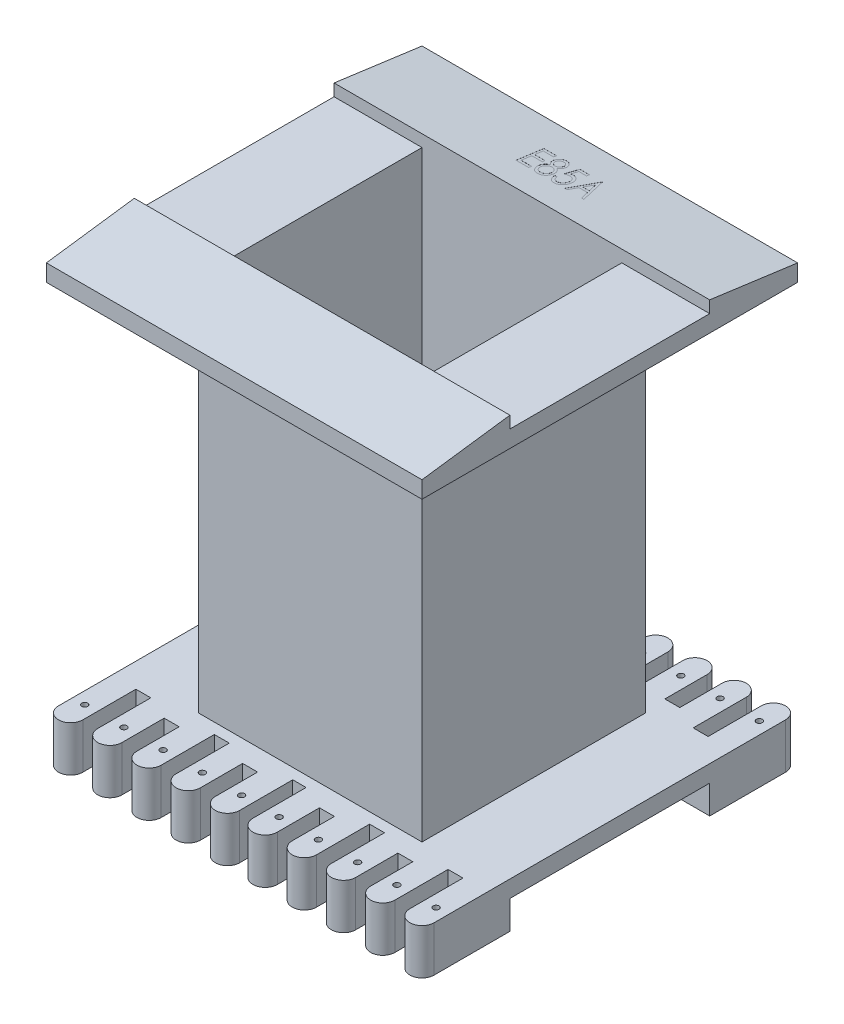
from build123d import *

# Parameters (mm, degrees)
SKETCH2_W           = 31.8
SKETCH2_H           = 31.8
SKETCH2_W_2         = 28.4
SKETCH2_H_2         = 28.4
BOSS_EXTRUDE1_DEPTH = 26.5
SKETCH4_W           = 53.4
SKETCH4_H           = 53.4
SKETCH4_W_2         = 28.4
SKETCH4_H_2         = 28.4
BOSS_EXTRUDE2_DEPTH = 2.4
BOSS_EXTRUDE3_DEPTH = 26.7
SKETCH7_R           = 0.425
CUT_EXTRUDE1_DEPTH  = 3
BOSS_EXTRUDE4_START = 4.05
BOSS_EXTRUDE4_DEPTH = 4.05
CUT_EXTRUDE2_DEPTH  = 0.01


with BuildPart() as part:
    # Sketch2 → Boss-Extrude1 (new, symmetric)
    with BuildSketch(Plane(origin=(0, 0, 0), x_dir=(1, 0, 0), z_dir=(0, 1, 0))):
        Rectangle(SKETCH2_W, SKETCH2_H)
        Rectangle(SKETCH2_W_2, SKETCH2_H_2, mode=Mode.SUBTRACT)
    extrude(amount=BOSS_EXTRUDE1_DEPTH, both=True)

    # Sketch4 → Boss-Extrude2 (add)
    with BuildSketch(Plane(origin=(0, 26.5, 0), x_dir=(1, 0, 0), z_dir=(0, 1, 0))):
        Rectangle(SKETCH4_W, SKETCH4_H)
        Rectangle(SKETCH4_W_2, SKETCH4_H_2, mode=Mode.SUBTRACT)
    boss_extrude2 = extrude(amount=BOSS_EXTRUDE2_DEPTH)

    # Mirror1: Boss-Extrude2 across plane
    add(boss_extrude2.mirror(Plane.ZX))

    # Sketch5 → Boss-Extrude3 (add, symmetric)
    with BuildSketch(Plane(origin=(0, 0, 0), x_dir=(0, 0, -1), z_dir=(1, 0, 0))):
        Polygon((-26.7, 28.9), (-14.2, 30.6), (-14.2, 28.9), align=None)
        Polygon((14.2, 30.6), (14.2, 28.9), (26.7, 28.9), align=None)
    extrude(amount=BOSS_EXTRUDE3_DEPTH, both=True)

    # Sketch7 → Cut-Extrude1 (cut)
    with BuildSketch(Plane.XZ.offset(28.9)):
        with Locations(Location((-24.975, 22.975, 0), (0, 0, 270))):
            Circle(SKETCH7_R)
        with Locations(Location((-19.4, 22.975, 0), (0, 0, 270))):
            Circle(SKETCH7_R)
        with Locations(Location((-13.825, 22.975, 0), (0, 0, 270))):
            Circle(SKETCH7_R)
        with Locations(Location((-8.25, 22.975, 0), (0, 0, 270))):
            Circle(SKETCH7_R)
        with Locations(Location((-2.675, 22.975, 0), (0, 0, 270))):
            Circle(SKETCH7_R)
        with Locations(Location((19.4, 22.975, 0), (0, 0, 90))):
            Circle(SKETCH7_R)
        with Locations(Location((13.825, 22.975, 0), (0, 0, 90))):
            Circle(SKETCH7_R)
        with Locations(Location((8.25, 22.975, 0), (0, 0, 90))):
            Circle(SKETCH7_R)
        with Locations(Location((2.675, 22.975, 0), (0, 0, 90))):
            Circle(SKETCH7_R)
        with Locations(Location((24.975, 22.975, 0), (0, 0, 90))):
            Circle(SKETCH7_R)
        with Locations(Location((24.975, -22.975, 0), (0, 0, 270))):
            Circle(SKETCH7_R)
        with Locations(Location((2.675, -22.975, 0), (0, 0, 270))):
            Circle(SKETCH7_R)
        with Locations(Location((8.25, -22.975, 0), (0, 0, 270))):
            Circle(SKETCH7_R)
        with Locations(Location((13.825, -22.975, 0), (0, 0, 270))):
            Circle(SKETCH7_R)
        with Locations(Location((19.4, -22.975, 0), (0, 0, 270))):
            Circle(SKETCH7_R)
        with Locations(Location((-2.675, -22.975, 0), (0, 0, 90))):
            Circle(SKETCH7_R)
        with Locations(Location((-8.25, -22.975, 0), (0, 0, 90))):
            Circle(SKETCH7_R)
        with Locations(Location((-13.825, -22.975, 0), (0, 0, 90))):
            Circle(SKETCH7_R)
        with Locations(Location((-19.4, -22.975, 0), (0, 0, 90))):
            Circle(SKETCH7_R)
        with Locations(Location((-24.975, -22.975, 0), (0, 0, 90))):
            Circle(SKETCH7_R)
        with BuildLine():
            Line((-26.7, 26.7), (-26.7, 24.975))
            ThreePointArc((-26.7, 24.975), (-24.975, 26.7), (-23.25, 24.975))
            Line((-23.25, 24.975), (-23.25, 17.425))
            Line((-23.25, 17.425), (-21.125, 17.425))
            Line((-21.125, 17.425), (-21.125, 24.975))
            ThreePointArc((-21.125, 24.975), (-19.4, 26.7), (-17.675, 24.975))
            Line((-17.675, 24.975), (-17.675, 18.975))
            Line((-17.675, 18.975), (-15.55, 18.975))
            Line((-15.55, 18.975), (-15.55, 24.975))
            ThreePointArc((-15.55, 24.975), (-13.825, 26.7), (-12.1, 24.975))
            Line((-12.1, 24.975), (-12.1, 17.425))
            Line((-12.1, 17.425), (-9.975, 17.425))
            Line((-9.975, 17.425), (-9.975, 24.975))
            ThreePointArc((-9.975, 24.975), (-8.25, 26.7), (-6.525, 24.975))
            Line((-6.525, 24.975), (-6.525, 18.975))
            Line((-6.525, 18.975), (-4.4, 18.975))
            Line((-4.4, 18.975), (-4.4, 24.975))
            ThreePointArc((-4.4, 24.975), (-2.675, 26.7), (-0.95, 24.975))
            Line((-0.95, 24.975), (-0.95, 17.425))
            Line((-0.95, 17.425), (0.95, 17.425))
            Line((0.95, 17.425), (0.95, 24.975))
            ThreePointArc((0.95, 24.975), (2.675, 26.7), (4.4, 24.975))
            Line((4.4, 24.975), (4.4, 18.975))
            Line((4.4, 18.975), (6.525, 18.975))
            Line((6.525, 18.975), (6.525, 24.975))
            ThreePointArc((6.525, 24.975), (8.25, 26.7), (9.975, 24.975))
            Line((9.975, 24.975), (9.975, 17.425))
            Line((9.975, 17.425), (12.1, 17.425))
            Line((12.1, 17.425), (12.1, 24.975))
            ThreePointArc((12.1, 24.975), (13.825, 26.7), (15.55, 24.975))
            Line((15.55, 24.975), (15.55, 18.975))
            Line((15.55, 18.975), (17.675, 18.975))
            Line((17.675, 18.975), (17.675, 24.975))
            ThreePointArc((17.675, 24.975), (19.4, 26.7), (21.125, 24.975))
            Line((21.125, 24.975), (21.125, 17.425))
            Line((21.125, 17.425), (23.25, 17.425))
            Line((23.25, 17.425), (23.25, 24.975))
            ThreePointArc((23.25, 24.975), (24.975, 26.7), (26.7, 24.975))
            Line((26.7, 24.975), (26.7, 27.95))
            Line((26.7, 27.95), (-26.7, 27.95))
            Line((-26.7, 27.95), (-26.7, 26.7))
        make_face()
        with BuildLine():
            Line((0.95, -17.425), (0.95, -24.975))
            ThreePointArc((0.95, -24.975), (2.675, -26.7), (4.4, -24.975))
            Line((4.4, -24.975), (4.4, -18.975))
            Line((4.4, -18.975), (6.525, -18.975))
            Line((6.525, -18.975), (6.525, -24.975))
            ThreePointArc((6.525, -24.975), (8.25, -26.7), (9.975, -24.975))
            Line((9.975, -24.975), (9.975, -17.425))
            Line((9.975, -17.425), (12.1, -17.425))
            Line((12.1, -17.425), (12.1, -24.975))
            ThreePointArc((12.1, -24.975), (13.825, -26.7), (15.55, -24.975))
            Line((15.55, -24.975), (15.55, -18.975))
            Line((15.55, -18.975), (17.675, -18.975))
            Line((17.675, -18.975), (17.675, -24.975))
            ThreePointArc((17.675, -24.975), (19.4, -26.7), (21.125, -24.975))
            Line((21.125, -24.975), (21.125, -17.425))
            Line((21.125, -17.425), (23.25, -17.425))
            Line((23.25, -17.425), (23.25, -24.975))
            ThreePointArc((23.25, -24.975), (24.975, -26.7), (26.7, -24.975))
            Line((26.7, -24.975), (26.7, -27.95))
            Line((26.7, -27.95), (-26.7, -27.95))
            Line((-26.7, -27.95), (-26.7, -26.7))
            Line((-26.7, -26.7), (-26.7, -24.975))
            ThreePointArc((-26.7, -24.975), (-24.975, -26.7), (-23.25, -24.975))
            Line((-23.25, -24.975), (-23.25, -17.425))
            Line((-23.25, -17.425), (-21.125, -17.425))
            Line((-21.125, -17.425), (-21.125, -24.975))
            ThreePointArc((-21.125, -24.975), (-19.4, -26.7), (-17.675, -24.975))
            Line((-17.675, -24.975), (-17.675, -18.975))
            Line((-17.675, -18.975), (-15.55, -18.975))
            Line((-15.55, -18.975), (-15.55, -24.975))
            ThreePointArc((-15.55, -24.975), (-13.825, -26.7), (-12.1, -24.975))
            Line((-12.1, -24.975), (-12.1, -17.425))
            Line((-12.1, -17.425), (-9.975, -17.425))
            Line((-9.975, -17.425), (-9.975, -24.975))
            ThreePointArc((-9.975, -24.975), (-8.25, -26.7), (-6.525, -24.975))
            Line((-6.525, -24.975), (-6.525, -18.975))
            Line((-6.525, -18.975), (-4.4, -18.975))
            Line((-4.4, -18.975), (-4.4, -24.975))
            ThreePointArc((-4.4, -24.975), (-2.675, -26.7), (-0.95, -24.975))
            Line((-0.95, -24.975), (-0.95, -17.425))
            Line((-0.95, -17.425), (0.95, -17.425))
        make_face()
    extrude(amount=-CUT_EXTRUDE1_DEPTH, mode=Mode.SUBTRACT)

    # Sketch8 → Boss-Extrude4 (add)
    with BuildSketch(Plane.XZ.offset(28.9).offset(BOSS_EXTRUDE4_START)):
        with BuildLine():
            Line((-26.7, 14.2), (26.7, 14.2))
            Line((26.7, 14.2), (26.7, 24.975))
            ThreePointArc((26.7, 24.975), (24.975, 26.7), (23.25, 24.975))
            Line((23.25, 24.975), (23.25, 17.425))
            Line((23.25, 17.425), (21.125, 17.425))
            Line((21.125, 17.425), (21.125, 24.975))
            ThreePointArc((21.125, 24.975), (19.4, 26.7), (17.675, 24.975))
            Line((17.675, 24.975), (17.675, 18.975))
            Line((17.675, 18.975), (15.55, 18.975))
            Line((15.55, 18.975), (15.55, 24.975))
            ThreePointArc((15.55, 24.975), (13.825, 26.7), (12.1, 24.975))
            Line((12.1, 24.975), (12.1, 17.425))
            Line((12.1, 17.425), (9.975, 17.425))
            Line((9.975, 17.425), (9.975, 24.975))
            ThreePointArc((9.975, 24.975), (8.25, 26.7), (6.525, 24.975))
            Line((6.525, 24.975), (6.525, 18.975))
            Line((6.525, 18.975), (4.4, 18.975))
            Line((4.4, 18.975), (4.4, 24.975))
            ThreePointArc((4.4, 24.975), (2.675, 26.7), (0.95, 24.975))
            Line((0.95, 24.975), (0.95, 17.425))
            Line((0.95, 17.425), (-0.95, 17.425))
            Line((-0.95, 17.425), (-0.95, 24.975))
            ThreePointArc((-0.95, 24.975), (-2.675, 26.7), (-4.4, 24.975))
            Line((-4.4, 24.975), (-4.4, 18.975))
            Line((-4.4, 18.975), (-6.525, 18.975))
            Line((-6.525, 18.975), (-6.525, 24.975))
            ThreePointArc((-6.525, 24.975), (-8.25, 26.7), (-9.975, 24.975))
            Line((-9.975, 24.975), (-9.975, 17.425))
            Line((-9.975, 17.425), (-12.1, 17.425))
            Line((-12.1, 17.425), (-12.1, 24.975))
            ThreePointArc((-12.1, 24.975), (-13.825, 26.7), (-15.55, 24.975))
            Line((-15.55, 24.975), (-15.55, 18.975))
            Line((-15.55, 18.975), (-17.675, 18.975))
            Line((-17.675, 18.975), (-17.675, 24.975))
            ThreePointArc((-17.675, 24.975), (-19.4, 26.7), (-21.125, 24.975))
            Line((-21.125, 24.975), (-21.125, 17.425))
            Line((-21.125, 17.425), (-23.25, 17.425))
            Line((-23.25, 17.425), (-23.25, 24.975))
            ThreePointArc((-23.25, 24.975), (-24.975, 26.7), (-26.7, 24.975))
            Line((-26.7, 24.975), (-26.7, 14.2))
        make_face()
        with BuildLine():
            Line((-26.7, -24.975), (-26.7, -14.2))
            Line((-26.7, -14.2), (26.7, -14.2))
            Line((26.7, -14.2), (26.7, -24.975))
            ThreePointArc((26.7, -24.975), (24.975, -26.7), (23.25, -24.975))
            Line((23.25, -24.975), (23.25, -17.425))
            Line((23.25, -17.425), (21.125, -17.425))
            Line((21.125, -17.425), (21.125, -24.975))
            ThreePointArc((21.125, -24.975), (19.4, -26.7), (17.675, -24.975))
            Line((17.675, -24.975), (17.675, -18.975))
            Line((17.675, -18.975), (15.55, -18.975))
            Line((15.55, -18.975), (15.55, -24.975))
            ThreePointArc((15.55, -24.975), (13.825, -26.7), (12.1, -24.975))
            Line((12.1, -24.975), (12.1, -17.425))
            Line((12.1, -17.425), (9.975, -17.425))
            Line((9.975, -17.425), (9.975, -24.975))
            ThreePointArc((9.975, -24.975), (8.25, -26.7), (6.525, -24.975))
            Line((6.525, -24.975), (6.525, -18.975))
            Line((6.525, -18.975), (4.4, -18.975))
            Line((4.4, -18.975), (4.4, -24.975))
            ThreePointArc((4.4, -24.975), (2.675, -26.7), (0.95, -24.975))
            Line((0.95, -24.975), (0.95, -17.425))
            Line((0.95, -17.425), (-0.95, -17.425))
            Line((-0.95, -17.425), (-0.95, -24.975))
            ThreePointArc((-0.95, -24.975), (-2.675, -26.7), (-4.4, -24.975))
            Line((-4.4, -24.975), (-4.4, -18.975))
            Line((-4.4, -18.975), (-6.525, -18.975))
            Line((-6.525, -18.975), (-6.525, -24.975))
            ThreePointArc((-6.525, -24.975), (-8.25, -26.7), (-9.975, -24.975))
            Line((-9.975, -24.975), (-9.975, -17.425))
            Line((-9.975, -17.425), (-12.1, -17.425))
            Line((-12.1, -17.425), (-12.1, -24.975))
            ThreePointArc((-12.1, -24.975), (-13.825, -26.7), (-15.55, -24.975))
            Line((-15.55, -24.975), (-15.55, -18.975))
            Line((-15.55, -18.975), (-17.675, -18.975))
            Line((-17.675, -18.975), (-17.675, -24.975))
            ThreePointArc((-17.675, -24.975), (-19.4, -26.7), (-21.125, -24.975))
            Line((-21.125, -24.975), (-21.125, -17.425))
            Line((-21.125, -17.425), (-23.25, -17.425))
            Line((-23.25, -17.425), (-23.25, -24.975))
            ThreePointArc((-23.25, -24.975), (-24.975, -26.7), (-26.7, -24.975))
        make_face()
    extrude(amount=-BOSS_EXTRUDE4_DEPTH)

    # Sketch9 → Cut-Extrude2 (cut)
    # profile 1 of 4: a face of its own
    with BuildSketch(Plane(origin=(0, 31.94042981, -4.343898454), x_dir=(1, 0, 0), z_dir=(0, 0.9908783423839452, -0.13475945456421662))):
        Polygon((-4.794871795, 17.946833152), (-3, 17.946833152), (-3, 17.536576742), (-4.487179487, 17.536576742), (-4.487179487, 16.305807511), (-3, 16.305807511), (-3, 15.895551101), (-4.487179487, 15.895551101), (-4.487179487, 14.357089562), (-3, 14.357089562), (-3, 13.946833152), (-4.794871795, 13.946833152), align=None)
    # profile 2 of 4: a face of its own
    with BuildSketch(Plane(origin=(0, 31.94042981, -4.343898454), x_dir=(1, 0, 0), z_dir=(0, 0.9908783423839452, -0.13475945456421662))):
        with BuildLine():
            add(Edge.make_bspline(
                [(-1.185096154, 16.175198537), (-1.135626284, 16.141056591), (-1.04005113, 16.075094787), (-0.914790112, 15.960788774), (-0.810265914, 15.839953271), (-0.728041652, 15.710316771), (-0.665735209, 15.573158313), (-0.621571795, 15.427435632), (-0.594527612, 15.272624301), (-0.591360756, 15.166228587), (-0.58974359, 15.111897255)],
                knots=[0, 0, 0, 0, 1.128817125, 2.180860238, 3.177988592, 4.123737061, 5.056171269, 6.001159785, 6.979285454, 8, 8, 8, 8], degree=3))
            add(Edge.make_bspline(
                [(-0.58974359, 15.111897255), (-0.59064271, 15.073416372), (-0.592419208, 14.997385205), (-0.602642688, 14.884853435), (-0.621142605, 14.77589293), (-0.647046954, 14.670185914), (-0.679464719, 14.5679622), (-0.720106353, 14.469182218), (-0.76781206, 14.374069571), (-0.805107424, 14.313564078), (-0.823717949, 14.283371614)],
                knots=[0, 0, 0, 0, 1.057772661, 2.089964817, 3.102547595, 4.092524029, 5.079228706, 6.047156722, 7.025523981, 8, 8, 8, 8], degree=3))
            add(Edge.make_bspline(
                [(-0.823717949, 14.283371614), (-0.848331695, 14.24858759), (-0.896545895, 14.180451521), (-0.980326536, 14.090330734), (-1.071832239, 14.013614971), (-1.171885186, 13.951806315), (-1.279365151, 13.903349482), (-1.394289356, 13.868550742), (-1.517199317, 13.848578888), (-1.601690308, 13.845730302), (-1.645032051, 13.84426905)],
                knots=[0, 0, 0, 0, 1.048906327, 2.054631539, 3.021839926, 3.982309668, 4.942418687, 5.918716991, 6.932354415, 8, 8, 8, 8], degree=3))
            add(Edge.make_bspline(
                [(-1.645032051, 13.84426905), (-1.686755969, 13.845578261), (-1.767918209, 13.848124965), (-1.886102142, 13.865652649), (-1.995989766, 13.896219672), (-2.098668658, 13.937965954), (-2.192974343, 13.993169036), (-2.279823877, 14.059765922), (-2.358694892, 14.138752147), (-2.42790694, 14.229091764), (-2.489619851, 14.326028876), (-2.54350424, 14.426590179), (-2.589289403, 14.529427296), (-2.62730228, 14.634542595), (-2.656033908, 14.742393782), (-2.676777414, 14.852460047), (-2.690262242, 14.964927669), (-2.691622402, 15.040811869), (-2.692307692, 15.079044691)],
                knots=[0, 0, 0, 0, 1.104708739, 2.14890257, 3.154370595, 4.118367704, 5.075413289, 6.038709714, 7.008861323, 8.021763411, 9.045837506, 10.048840199, 11.039777576, 12.024055369, 13.005330523, 13.991512021, 14.988061252, 16, 16, 16, 16], degree=3))
            add(Edge.make_bspline(
                [(-2.692307692, 15.079044691), (-2.690667664, 15.134434789), (-2.68745512, 15.242934788), (-2.660659375, 15.401356531), (-2.615114723, 15.550656294), (-2.563811585, 15.668914986), (-2.512761874, 15.75856408), (-2.468221188, 15.823664599), (-2.41849553, 15.887406662), (-2.362107521, 15.948574713), (-2.301387434, 16.009058212), (-2.234270156, 16.066890425), (-2.161758858, 16.122791063), (-2.11023677, 16.157575846), (-2.084134615, 16.175198537)],
                knots=[0, 0, 0, 0, 1.517674003, 2.972871206, 4.388029641, 5.787820883, 6.496147795, 7.212975084, 7.948222945, 8.710108948, 9.49185787, 10.296315951, 11.136878426, 12, 12, 12, 12], degree=3))
            add(Edge.make_bspline(
                [(-2.084134615, 16.175198537), (-2.1204404, 16.200676675), (-2.191744723, 16.250715572), (-2.283763742, 16.341173875), (-2.363876067, 16.438473636), (-2.427598718, 16.545578043), (-2.477370021, 16.658722209), (-2.512814344, 16.77657027), (-2.534212316, 16.898511285), (-2.537035894, 16.981203206), (-2.538461538, 17.022954947)],
                knots=[0, 0, 0, 0, 1.058972266, 2.079814596, 3.074322664, 4.065626078, 5.049411374, 6.023340544, 7.001970524, 8, 8, 8, 8], degree=3))
            add(Edge.make_bspline(
                [(-2.538461538, 17.022954947), (-2.537250877, 17.065546678), (-2.534826501, 17.150837483), (-2.509490862, 17.277377064), (-2.473659219, 17.403179659), (-2.420052602, 17.524631516), (-2.356128477, 17.640327157), (-2.277408793, 17.743718972), (-2.187838154, 17.834424953), (-2.087745442, 17.911072886), (-1.980063581, 17.973430851), (-1.86570671, 18.016473242), (-1.747607768, 18.044496498), (-1.6670907, 18.04775747), (-1.626602564, 18.049397255)],
                knots=[0, 0, 0, 0, 1.006801535, 2.016140496, 3.04434944, 4.097767983, 5.150882958, 6.16620321, 7.163091172, 8.159497914, 9.142029795, 10.096562843, 11.042853592, 12, 12, 12, 12], degree=3))
            add(Edge.make_bspline(
                [(-1.626602564, 18.049397255), (-1.586927915, 18.047727927), (-1.50828014, 18.044418787), (-1.392872522, 18.017021494), (-1.283001498, 17.971343283), (-1.178853838, 17.909254748), (-1.081763115, 17.83274871), (-0.996006953, 17.740978796), (-0.919694516, 17.637969958), (-0.857553258, 17.522818099), (-0.807170964, 17.40056479), (-0.770066589, 17.273897116), (-0.747708729, 17.143672464), (-0.744968292, 17.055893364), (-0.743589744, 17.011736998)],
                knots=[0, 0, 0, 0, 0.945268751, 1.87382339, 2.810620796, 3.772987939, 4.756784404, 5.747996242, 6.759505551, 7.805656055, 8.859553138, 9.907698875, 10.947489625, 12, 12, 12, 12], degree=3))
            add(Edge.make_bspline(
                [(-0.743589744, 17.011736998), (-0.74508208, 16.96840226), (-0.748000338, 16.883661357), (-0.767722762, 16.759812765), (-0.80368054, 16.64384312), (-0.851869477, 16.534637948), (-0.913792032, 16.432544739), (-0.991704326, 16.339322193), (-1.080947463, 16.250943489), (-1.149923897, 16.200778512), (-1.185096154, 16.175198537)],
                knots=[0, 0, 0, 0, 1.053501153, 2.060117211, 3.037794984, 3.997036466, 4.955838333, 5.929389179, 6.944160328, 8, 8, 8, 8], degree=3))
        make_face()
        with BuildLine():
            add(Edge.make_bspline(
                [(-1.641826923, 17.639140844), (-1.662678905, 17.638402398), (-1.703467153, 17.636957933), (-1.763494128, 17.629218021), (-1.82055157, 17.614386077), (-1.87547098, 17.594810697), (-1.926699457, 17.567534224), (-1.976294575, 17.536683208), (-2.021917258, 17.498279376), (-2.078811567, 17.441471512), (-2.139655068, 17.361661437), (-2.192601817, 17.254855601), (-2.225176639, 17.138895775), (-2.228879214, 17.058423739), (-2.230769231, 17.017345973)],
                knots=[0, 0, 0, 0, 0.787074358, 1.539584277, 2.277719126, 3.007830531, 3.733477235, 4.463101644, 5.207606632, 5.977196966, 7.494883027, 8.968605234, 10.452593816, 12, 12, 12, 12], degree=3))
            add(Edge.make_bspline(
                [(-2.230769231, 17.017345973), (-2.228665957, 16.976239157), (-2.224482932, 16.894485226), (-2.188867873, 16.77541559), (-2.132035496, 16.662496247), (-2.06664942, 16.576633955), (-2.007012568, 16.51320049), (-1.959078513, 16.471395948), (-1.908625945, 16.436545535), (-1.85683746, 16.407800217), (-1.803255728, 16.3847666), (-1.747788553, 16.368919548), (-1.690270484, 16.358837761), (-1.651217522, 16.357677855), (-1.631410256, 16.357089562)],
                knots=[0, 0, 0, 0, 1.503377697, 2.989943038, 4.512810598, 6.113657223, 6.923460787, 7.700377033, 8.438683534, 9.16575144, 9.867283722, 10.570247634, 11.274844133, 12, 12, 12, 12], degree=3))
            add(Edge.make_bspline(
                [(-1.631410256, 16.357089562), (-1.606196254, 16.358099133), (-1.555679017, 16.360121846), (-1.481427597, 16.37879579), (-1.409376955, 16.40784305), (-1.340505481, 16.448300462), (-1.275827454, 16.498121943), (-1.218726845, 16.55831185), (-1.168468483, 16.626290838), (-1.126631667, 16.701877917), (-1.09368888, 16.781657004), (-1.069129611, 16.862632371), (-1.054125349, 16.943870285), (-1.052225424, 16.998321851), (-1.051282051, 17.025358793)],
                knots=[0, 0, 0, 0, 0.926959826, 1.857200198, 2.801319747, 3.77959719, 4.788725481, 5.797230661, 6.823935113, 7.893723746, 8.969417254, 9.996121706, 11.005010385, 12, 12, 12, 12], degree=3))
            add(Edge.make_bspline(
                [(-1.051282051, 17.025358793), (-1.053161529, 17.062924049), (-1.056893494, 17.137515102), (-1.086111821, 17.246722482), (-1.134580984, 17.350647847), (-1.189027327, 17.431916831), (-1.241693246, 17.491441387), (-1.286152831, 17.531251289), (-1.334999432, 17.564654529), (-1.387986913, 17.592831335), (-1.445735382, 17.612864339), (-1.507300952, 17.628632351), (-1.5732138, 17.637159563), (-1.618567984, 17.638469216), (-1.641826923, 17.639140844)],
                knots=[0, 0, 0, 0, 1.41789026, 2.815418751, 4.237647105, 5.734964885, 6.492513555, 7.235814941, 7.983146572, 8.723359292, 9.495815479, 10.286317727, 11.121174114, 12, 12, 12, 12], degree=3))
        make_face(mode=Mode.SUBTRACT)
        with BuildLine():
            add(Edge.make_bspline(
                [(-1.625, 15.946833152), (-1.65151015, 15.946208302), (-1.703521085, 15.944982394), (-1.779607047, 15.930973817), (-1.852853842, 15.911818819), (-1.922621411, 15.882126066), (-1.989125385, 15.844623693), (-2.052035627, 15.798026565), (-2.112337363, 15.744556402), (-2.167780198, 15.682787063), (-2.218571481, 15.616410029), (-2.262946944, 15.546082173), (-2.300775648, 15.473277765), (-2.331270711, 15.397250494), (-2.3555483, 15.318789448), (-2.372073535, 15.237171194), (-2.383044784, 15.153062692), (-2.384088156, 15.095906956), (-2.384615385, 15.06702546)],
                knots=[0, 0, 0, 0, 0.9847572, 1.932020036, 2.869543467, 3.795734653, 4.743309996, 5.703045184, 6.702129772, 7.735926045, 8.785026717, 9.807544264, 10.825030468, 11.832280622, 12.85044557, 13.875276944, 14.92635129, 16, 16, 16, 16], degree=3))
            add(Edge.make_bspline(
                [(-2.384615385, 15.06702546), (-2.383664751, 15.031150106), (-2.381787006, 14.960287092), (-2.362859469, 14.855617419), (-2.334711629, 14.753706238), (-2.293421554, 14.656383429), (-2.243560417, 14.56523028), (-2.181220632, 14.485216706), (-2.111757652, 14.414347536), (-2.031490856, 14.356705176), (-1.944013646, 14.310418264), (-1.84888696, 14.278865883), (-1.747732644, 14.257627411), (-1.677731807, 14.255577105), (-1.641826923, 14.25452546)],
                knots=[0, 0, 0, 0, 1.046503232, 2.067112015, 3.096621624, 4.12790218, 5.147527128, 6.120914979, 7.080488514, 8.035200521, 8.994520469, 9.958867953, 10.953060937, 12, 12, 12, 12], degree=3))
            add(Edge.make_bspline(
                [(-1.641826923, 14.25452546), (-1.614000863, 14.255245152), (-1.559679327, 14.256650122), (-1.480434778, 14.269096485), (-1.405561893, 14.288799944), (-1.33540054, 14.317438855), (-1.268730332, 14.352585495), (-1.207344684, 14.397133706), (-1.149415402, 14.44863533), (-1.098513051, 14.509012304), (-1.051110681, 14.573244288), (-1.010609789, 14.641780389), (-0.974680423, 14.712037272), (-0.947142874, 14.78567401), (-0.923841724, 14.861174913), (-0.909463614, 14.940011948), (-0.899104892, 15.021345483), (-0.897998233, 15.076605821), (-0.897435897, 15.104685716)],
                knots=[0, 0, 0, 0, 1.057208993, 2.063864431, 3.041686247, 3.993867019, 4.938765438, 5.899569259, 6.870141775, 7.877872017, 8.895376391, 9.901878192, 10.900874436, 11.890851383, 12.886746751, 13.900342611, 14.933083623, 16, 16, 16, 16], degree=3))
            add(Edge.make_bspline(
                [(-0.897435897, 15.104685716), (-0.897924631, 15.131972735), (-0.89888668, 15.185686042), (-0.910344564, 15.264861308), (-0.925671947, 15.342029343), (-0.949150056, 15.416906555), (-0.979853384, 15.489149206), (-1.016839264, 15.559120213), (-1.060325784, 15.626627201), (-1.109634942, 15.690928781), (-1.163270948, 15.750701834), (-1.221136347, 15.802901456), (-1.281452612, 15.847355507), (-1.344477698, 15.883929885), (-1.410673709, 15.912205365), (-1.479842369, 15.932111673), (-1.551632484, 15.944601112), (-1.600376633, 15.946084042), (-1.625, 15.946833152)],
                knots=[0, 0, 0, 0, 1.062772706, 2.092021773, 3.112970097, 4.127207538, 5.144326494, 6.168931198, 7.208606358, 8.270613836, 9.324630021, 10.334529776, 11.302840154, 12.240380969, 13.168626316, 14.101066092, 15.040743392, 16, 16, 16, 16], degree=3))
        make_face(mode=Mode.SUBTRACT)
    # profile 3 of 4: a face of its own
    with BuildSketch(Plane(origin=(0, 31.94042981, -4.343898454), x_dir=(1, 0, 0), z_dir=(0, 0.9908783423839452, -0.13475945456421662))):
        with BuildLine():
            Line((1.666666667, 17.946833152), (1.666666667, 17.536576742))
            Line((1.666666667, 17.536576742), (0.582532051, 17.536576742))
            Line((0.582532051, 17.536576742), (0.420673077, 16.48128828))
            add(Edge.make_bspline(
                [(0.420673077, 16.48128828), (0.453617749, 16.493576108), (0.517175224, 16.517282013), (0.611750519, 16.54287006), (0.701606708, 16.559406831), (0.760084117, 16.561299371), (0.788461538, 16.562217768)],
                knots=[0, 0, 0, 0, 1.113577535, 2.148334562, 3.101439487, 4, 4, 4, 4], degree=3))
            add(Edge.make_bspline(
                [(0.788461538, 16.562217768), (0.823266725, 16.561261816), (0.891740394, 16.559381133), (0.992021095, 16.54082834), (1.087852896, 16.512162002), (1.178924637, 16.471917203), (1.26500229, 16.419842685), (1.345957709, 16.355811854), (1.423466548, 16.281251809), (1.493898732, 16.194498165), (1.5584294, 16.099977306), (1.614984032, 15.99802962), (1.662806587, 15.889926493), (1.702692059, 15.775390791), (1.731688646, 15.653910303), (1.753144296, 15.526219156), (1.767491707, 15.392136525), (1.768643015, 15.300503658), (1.769230769, 15.253724178)],
                knots=[0, 0, 0, 0, 0.915452749, 1.801007638, 2.675239231, 3.544138018, 4.414827501, 5.316484203, 6.256349044, 7.24041834, 8.25264956, 9.266198822, 10.305020537, 11.361306631, 12.454513165, 13.588568039, 14.768940248, 16, 16, 16, 16], degree=3))
            add(Edge.make_bspline(
                [(1.769230769, 15.253724178), (1.767666555, 15.188986692), (1.764588309, 15.061588592), (1.736443679, 14.87499519), (1.69151676, 14.696441904), (1.629702124, 14.527917078), (1.552841282, 14.37270686), (1.461871583, 14.235400622), (1.35885148, 14.11611107), (1.260456918, 14.034639724), (1.178009436, 13.97773927), (1.112648947, 13.943204356), (1.045883059, 13.911927267), (0.976262367, 13.887521397), (0.904529838, 13.867931978), (0.830227331, 13.854706087), (0.753717965, 13.845195254), (0.701686145, 13.84457928), (0.675480769, 13.84426905)],
                knots=[0, 0, 0, 0, 1.560107059, 3.070163622, 4.538401596, 5.993174223, 7.390017185, 8.704628562, 9.955064718, 11.175437472, 11.773810098, 12.367450782, 12.955334644, 13.550126979, 14.143767662, 14.746284672, 15.368577114, 16, 16, 16, 16], degree=3))
            add(Edge.make_bspline(
                [(0.675480769, 13.84426905), (0.644156666, 13.84506331), (0.5824586, 13.846627739), (0.492325901, 13.862883748), (0.4054898, 13.886488845), (0.322800471, 13.921402732), (0.243361593, 13.96582201), (0.168357606, 14.020747035), (0.096177778, 14.084367097), (0.02957855, 14.158323114), (-0.032668997, 14.239305898), (-0.08795816, 14.327262561), (-0.137210194, 14.420661428), (-0.179280556, 14.519995454), (-0.215660161, 14.624870121), (-0.245213802, 14.735434553), (-0.267689049, 14.851957738), (-0.277204527, 14.931804062), (-0.282051282, 14.972474178)],
                knots=[0, 0, 0, 0, 0.923275421, 1.818545566, 2.694317439, 3.573945876, 4.459590681, 5.373909434, 6.311768093, 7.29356341, 8.305513485, 9.322178447, 10.355055801, 11.417807359, 12.501966515, 13.627940912, 14.791780093, 16, 16, 16, 16], degree=3))
            Line((-0.282051282, 14.972474178), (0.025641026, 14.972474178))
            add(Edge.make_bspline(
                [(0.025641026, 14.972474178), (0.032197533, 14.934408075), (0.044729508, 14.861649294), (0.073133425, 14.75899499), (0.107151069, 14.667262363), (0.148132056, 14.585746514), (0.197187112, 14.514520263), (0.252177725, 14.450211574), (0.314704779, 14.393133354), (0.384472293, 14.344722537), (0.457997339, 14.304304475), (0.535388559, 14.27640354), (0.61394664, 14.257557727), (0.667361991, 14.255532186), (0.693910256, 14.25452546)],
                knots=[0, 0, 0, 0, 1.295040219, 2.475313703, 3.5669374, 4.572676558, 5.526934895, 6.460829183, 7.40583148, 8.357815864, 9.30383694, 10.210915259, 11.110796898, 12, 12, 12, 12], degree=3))
            add(Edge.make_bspline(
                [(0.693910256, 14.25452546), (0.71988254, 14.255472282), (0.771120406, 14.257340165), (0.846178643, 14.271499055), (0.918533239, 14.293825189), (0.987366587, 14.326735774), (1.054990616, 14.366425321), (1.117706105, 14.4180502), (1.179411436, 14.476478355), (1.236147531, 14.544451348), (1.288812528, 14.618558495), (1.335783442, 14.697804116), (1.373744225, 14.782572639), (1.406300242, 14.87102431), (1.430990782, 14.964143283), (1.448265091, 15.061723207), (1.460247288, 15.163683882), (1.461102289, 15.233389006), (1.461538462, 15.268948537)],
                knots=[0, 0, 0, 0, 0.883627968, 1.743212611, 2.591519239, 3.453888357, 4.334892888, 5.253609023, 6.211746337, 7.224577056, 8.261445484, 9.30467269, 10.354377667, 11.418591148, 12.510297713, 13.628489155, 14.790192039, 16, 16, 16, 16], degree=3))
            add(Edge.make_bspline(
                [(1.461538462, 15.268948537), (1.460953549, 15.301025022), (1.459810209, 15.363725519), (1.449996428, 15.455345283), (1.434147699, 15.54219671), (1.411647265, 15.624525181), (1.38267747, 15.702147116), (1.348466534, 15.775855602), (1.306455005, 15.844145678), (1.258302116, 15.907132511), (1.205982354, 15.965117264), (1.147987594, 16.015024321), (1.085316194, 16.056940474), (1.019173807, 16.092745207), (0.947731962, 16.11881528), (0.872684124, 16.138454169), (0.793063111, 16.149527829), (0.738547316, 16.151139299), (0.710737179, 16.151961357)],
                knots=[0, 0, 0, 0, 1.180781187, 2.308094721, 3.388266191, 4.428481563, 5.445995518, 6.435805344, 7.415746039, 8.391334499, 9.351887262, 10.286308742, 11.200059834, 12.123916071, 13.048190959, 13.992752428, 14.976043021, 16, 16, 16, 16], degree=3))
            add(Edge.make_bspline(
                [(0.710737179, 16.151961357), (0.686401663, 16.15131597), (0.636483764, 16.149992129), (0.559904844, 16.139692232), (0.479863999, 16.123705444), (0.396187651, 16.10090133), (0.308763677, 16.071915206), (0.217404595, 16.036415253), (0.122106409, 15.99496853), (0.058352979, 15.963156129), (0.025641026, 15.946833152)],
                knots=[0, 0, 0, 0, 0.80946005, 1.660394019, 2.566651373, 3.523765815, 4.543866754, 5.629776835, 6.783835928, 8, 8, 8, 8], degree=3))
            Line((0.025641026, 15.946833152), (0.333333333, 17.946833152))
            Line((0.333333333, 17.946833152), (1.666666667, 17.946833152))
        make_face()
    # profile 4 of 4: a face of its own
    with BuildSketch(Plane(origin=(0, 31.94042981, -4.343898454), x_dir=(1, 0, 0), z_dir=(0, 0.9908783423839452, -0.13475945456421662))):
        Polygon((3.512820513, 17.946833152), (4.846153846, 13.946833152), (4.511217949, 13.946833152), (4.084134615, 15.228884434), (2.890224359, 15.228884434), (2.463141026, 13.946833152), (2.128205128, 13.946833152), (3.461538462, 17.946833152), align=None)
        Polygon((3.487179487, 17.018948537), (3.02724359, 15.639140844), (3.947115385, 15.639140844), align=None, mode=Mode.SUBTRACT)
    extrude(amount=-CUT_EXTRUDE2_DEPTH, mode=Mode.SUBTRACT)


solid = part.part
